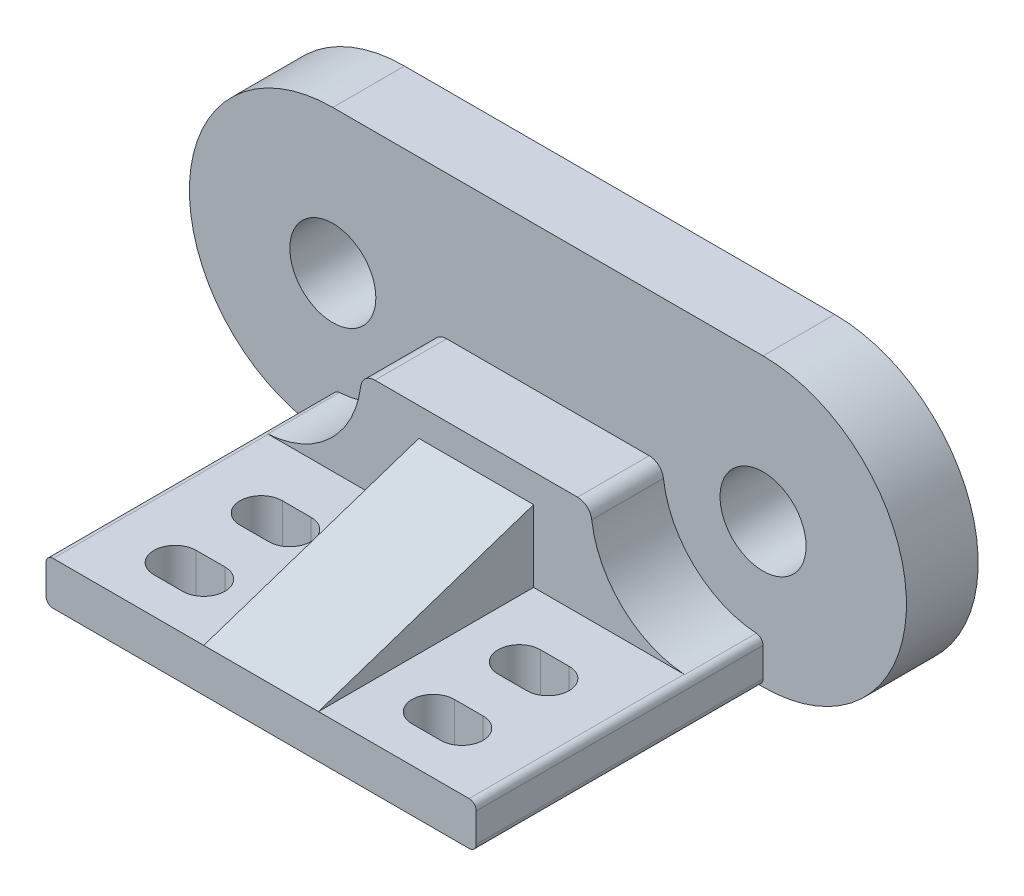
from build123d import *

# Parameters (mm, degrees)
SKETCH_1_R          = 3
EXTRUDE_1_DEPTH     = 5
EXTRUDE_3_DEPTH     = 10
EXTRUDE_4_DEPTH     = 15
EXTRUDE_5_DEPTH     = 4
CUT_EXTRUDE_1_DEPTH = 3.5


with BuildPart() as part:
    # 草图1 → 凸台-拉伸1 (new body)
    with BuildSketch(Plane.XY):
        with BuildLine():
            Line((-15, 10), (15, 10))
            ThreePointArc((15, 10), (25, 0), (15, -10))
            Line((15, -10), (-15, -10))
            ThreePointArc((-15, -10), (-25, 0), (-15, 10))
        make_face()
        with Locations((-15, 0)):
            Circle(SKETCH_1_R, mode=Mode.SUBTRACT)
        with Locations((15, 0)):
            Circle(SKETCH_1_R, mode=Mode.SUBTRACT)
    extrude(amount=EXTRUDE_1_DEPTH)

    # 草图4 → 凸台-拉伸3 (add)
    with BuildSketch(Plane.XY):
        with BuildLine():
            Line((7.062746067, 0), (-7.062746067, 0))
            ThreePointArc((-7.062746067, 0), (-7.724183895, -0.25), (-8.054902808, -0.875))
            ThreePointArc((-8.054902808, -0.875), (-10.197413633, -5.092657871), (-14.533333333, -6.984427122))
            ThreePointArc((-14.533333333, -6.984427122), (-14.865148372, -7.141749748), (-15, -7.483314774))
            Line((-15, -7.483314774), (-15, -9.5))
            ThreePointArc((-15, -9.5), (-14.853553391, -9.853553391), (-14.5, -10))
            Line((-14.5, -10), (14.5, -10))
            ThreePointArc((14.5, -10), (14.853553391, -9.853553391), (15, -9.5))
            Line((15, -9.5), (15, -7.483314774))
            ThreePointArc((15, -7.483314774), (14.865148372, -7.141749748), (14.533333333, -6.984427122))
            ThreePointArc((14.533333333, -6.984427122), (10.197413633, -5.092657871), (8.054902808, -0.875))
            ThreePointArc((8.054902808, -0.875), (7.724183895, -0.25), (7.062746067, 0))
        make_face()
    extrude(amount=EXTRUDE_3_DEPTH)

    # 草图5 → 凸台-拉伸4 (add)
    with BuildSketch(Plane.XY.offset(10)):
        with BuildLine():
            Line((-15, -7.483314774), (-15, -9.5))
            ThreePointArc((-15, -9.5), (-14.853553391, -9.853553391), (-14.5, -10))
            Line((-14.5, -10), (14.5, -10))
            ThreePointArc((14.5, -10), (14.853553391, -9.853553391), (15, -9.5))
            Line((15, -9.5), (15, -7.483314774))
            ThreePointArc((15, -7.483314774), (14.853553391, -7.129761383), (14.5, -6.983314774))
            Line((14.5, -6.983314774), (-14.5, -6.983314774))
            ThreePointArc((-14.5, -6.983314774), (-14.853553391, -7.129761383), (-15, -7.483314774))
        make_face()
    extrude(amount=EXTRUDE_4_DEPTH)

    # 草图9 → 凸台-拉伸5 (add, symmetric)
    with BuildSketch(Plane(origin=(0, 0, 0), x_dir=(0, 0, -1), z_dir=(1, 0, 0))):
        Polygon((-25, -6.983314774), (-10, -6.983314774), (-10, -1.983314774), align=None)
    extrude(amount=EXTRUDE_5_DEPTH, both=True)

    # 草图10 → 切除-拉伸1 (cut)
    with BuildSketch(Plane(origin=(0, -6.983314774, 0), x_dir=(1, 0, 0), z_dir=(0, 1, 0))):
        with BuildLine():
            Line((10, -13.525), (8, -13.525))
            ThreePointArc((8, -13.525), (6.525, -15), (8, -16.475))
            Line((8, -16.475), (10, -16.475))
            ThreePointArc((10, -16.475), (11.475, -15), (10, -13.525))
        make_face()
        with BuildLine():
            Line((8, -19.525), (10, -19.525))
            ThreePointArc((10, -19.525), (11.475, -21), (10, -22.475))
            Line((10, -22.475), (8, -22.475))
            ThreePointArc((8, -22.475), (6.525, -21), (8, -19.525))
        make_face()
        with BuildLine():
            Line((-10, -13.525), (-8, -13.525))
            ThreePointArc((-8, -13.525), (-6.525, -15), (-8, -16.475))
            Line((-8, -16.475), (-10, -16.475))
            ThreePointArc((-10, -16.475), (-11.475, -15), (-10, -13.525))
        make_face()
        with BuildLine():
            Line((-8, -19.525), (-10, -19.525))
            ThreePointArc((-10, -19.525), (-11.475, -21), (-10, -22.475))
            Line((-10, -22.475), (-8, -22.475))
            ThreePointArc((-8, -22.475), (-6.525, -21), (-8, -19.525))
        make_face()
    extrude(amount=-CUT_EXTRUDE_1_DEPTH, mode=Mode.SUBTRACT)


solid = part.part
